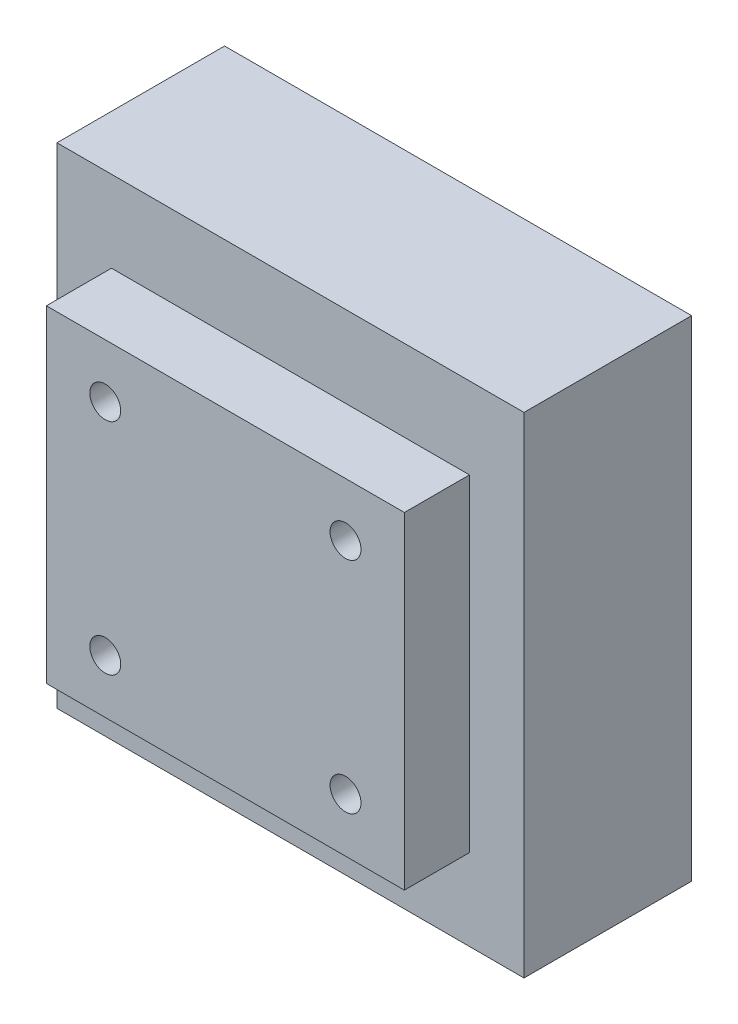
from build123d import *

# Parameters (mm, degrees)
SKETCH1_W           = 28.7
SKETCH1_H           = 30.1
BOSS_EXTRUDE1_DEPTH = 10.3
SKETCH2_W           = 22
SKETCH2_H           = 20.1
SKETCH2_R           = 0.95
BOSS_EXTRUDE2_DEPTH = 4
SKETCH4_R           = 0.95
CUT_EXTRUDE1_DEPTH  = 44.979427009


with BuildPart() as part:
    # Sketch1 → Boss-Extrude1 (new body)
    with BuildSketch(Plane.XY):
        with Locations((14.35, 15.05)):
            Rectangle(SKETCH1_W, SKETCH1_H)
    extrude(amount=BOSS_EXTRUDE1_DEPTH)

    # Sketch2 → Boss-Extrude2 (add)
    with BuildSketch(Plane.XY.offset(10.3)):
        with Locations((14.35, 15.05)):
            Rectangle(SKETCH2_W, SKETCH2_H)
        with Locations((6.967324962, 8.304919624)):
            Circle(SKETCH2_R, mode=Mode.SUBTRACT)
        with Locations(Location((6.967324962, 21.795080376, 0), (0, 0, 180))):
            Circle(SKETCH2_R, mode=Mode.SUBTRACT)
        with Locations(Location((21.732675038, 8.304919624, 0), (0, 0, 180))):
            Circle(SKETCH2_R, mode=Mode.SUBTRACT)
        with Locations((21.732675038, 21.795080376)):
            Circle(SKETCH2_R, mode=Mode.SUBTRACT)
    extrude(amount=BOSS_EXTRUDE2_DEPTH)

    # Sketch4 → Cut-Extrude1 (cut, through all)
    with BuildSketch(Plane(origin=(0, 0, 0), x_dir=(-1, 0, 0), z_dir=(0, 0, -1))):
        with Locations((-21.732675038, 21.795080376)):
            Circle(SKETCH4_R)
        with Locations((-21.732675038, 8.304919624)):
            Circle(SKETCH4_R)
        with Locations((-6.967324962, 8.304919624)):
            Circle(SKETCH4_R)
        with Locations((-6.967324962, 21.795080376)):
            Circle(SKETCH4_R)
    extrude(amount=-CUT_EXTRUDE1_DEPTH, mode=Mode.SUBTRACT)


solid = part.part
